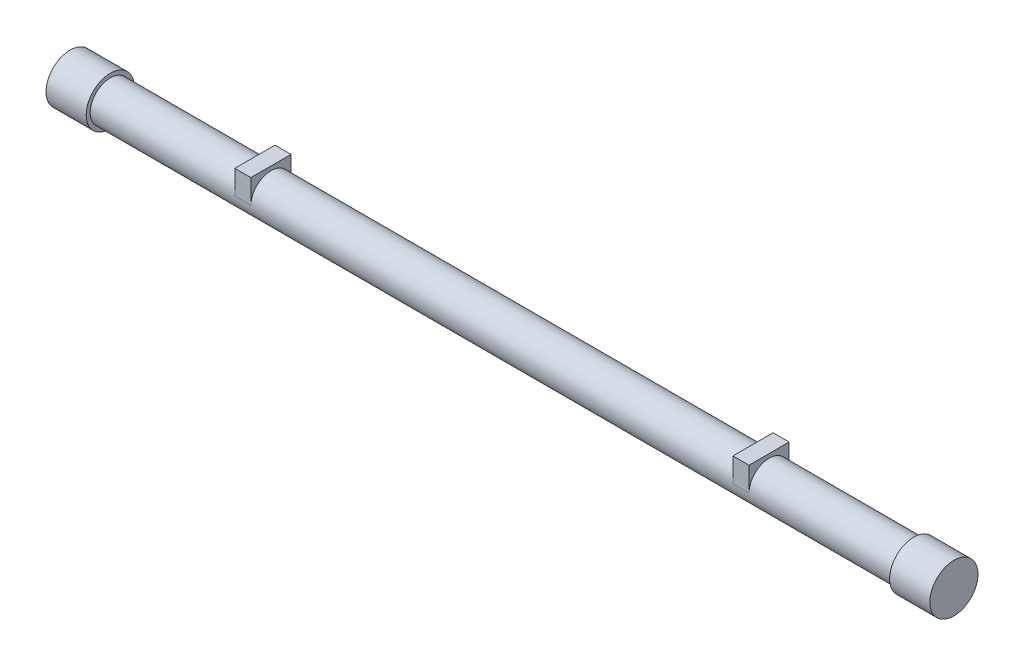
from build123d import *

# Parameters (mm, degrees)
SKETCH1_R           = 12.5
BOSS_EXTRUDE1_DEPTH = 550
SKETCH2_R           = 15
BOSS_EXTRUDE2_DEPTH = 25
BOSS_EXTRUDE3_START = -25
SKETCH3_R           = 15
BOSS_EXTRUDE3_DEPTH = 25
SKETCH4_W           = 10
SKETCH4_H           = 25
BOSS_EXTRUDE4_DEPTH = 15


with BuildPart() as part:
    # Sketch1 → Boss-Extrude1 (new body)
    with BuildSketch(Plane(origin=(0, 0, 0), x_dir=(0, 0, -1), z_dir=(1, 0, 0))):
        Circle(SKETCH1_R)
    extrude(amount=BOSS_EXTRUDE1_DEPTH)

    # Sketch2 → Boss-Extrude2 (add)
    with BuildSketch(Plane(origin=(550, 0, 0), x_dir=(0, 0, -1), z_dir=(1, 0, 0))):
        Circle(SKETCH2_R)
    extrude(amount=-BOSS_EXTRUDE2_DEPTH)

    # Sketch3 → Boss-Extrude3 (add)
    with BuildSketch(Plane.ZY.offset(BOSS_EXTRUDE3_START)):
        with Locations(Location((0, 0, 0), (0, 0, 180))):
            Circle(SKETCH3_R)
    extrude(amount=BOSS_EXTRUDE3_DEPTH)

    # Sketch4 → Boss-Extrude4 (add)
    with BuildSketch(Plane(origin=(0, 0, 0), x_dir=(1, 0, 0), z_dir=(0, 1, 0))):
        with Locations((120, 0)):
            Rectangle(SKETCH4_W, SKETCH4_H)
        with Locations((430, 0)):
            Rectangle(SKETCH4_W, SKETCH4_H)
    extrude(amount=BOSS_EXTRUDE4_DEPTH)


solid = part.part
